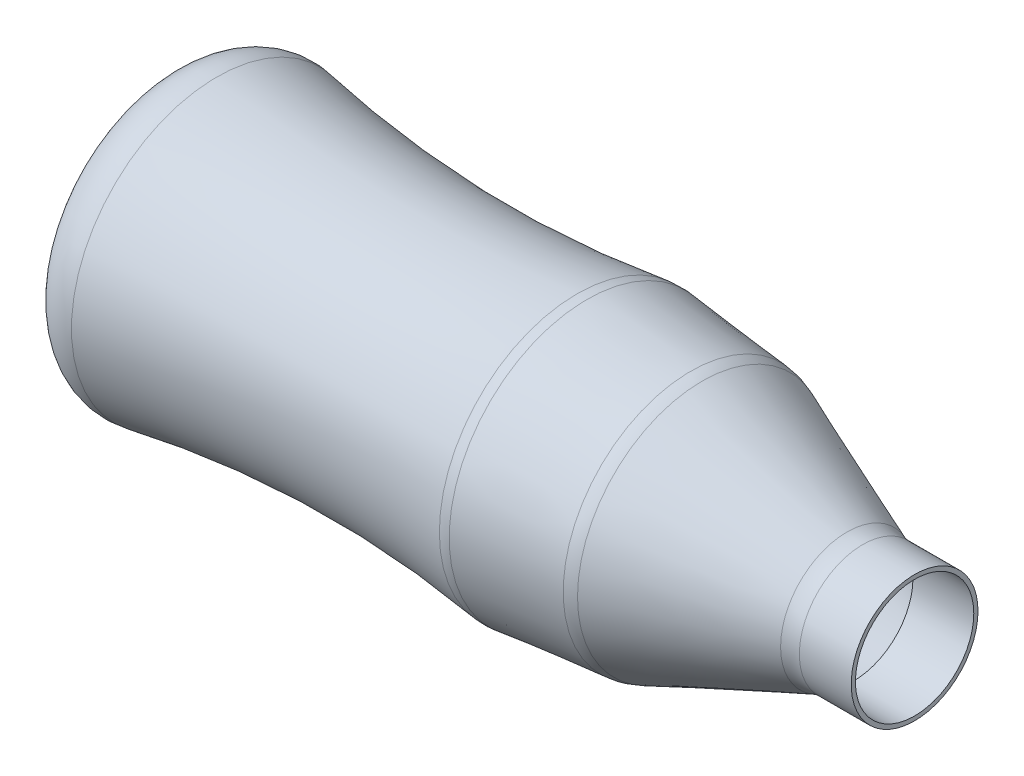
from build123d import *

# Parameters (mm, degrees)
FILLET1_R = 10


with BuildPart() as part:
    # Sketch1 → Revolve2 (revolve)
    with BuildSketch(Plane.XY, mode=Mode.PRIVATE) as revolve2_sk:
        with BuildLine():
            Line((-72.007624159, 0), (-72.007624159, 24.57))
            ThreePointArc((-72.007624159, 24.57), (-68.418740423, 32.244476415), (-60.228106509, 34.410392113))
            ThreePointArc((-60.228106509, 34.410392113), (-17.104532656, 30.124451731), (26.151893491, 32.75))
            Line((26.151893491, 32.75), (53.241893491, 30))
            Line((53.241893491, 30), (90.631893491, 15))
            Line((90.631893491, 15), (104.821893491, 15))
            Line((104.821893491, 15), (104.821893491, 14))
            Line((104.821893491, 14), (103.821893491, 14))
            Line((103.821893491, 14), (90.438785202, 14))
            Line((90.438785202, 14), (53.000518344, 29.019363543))
            Line((53.000518344, 29.019363543), (26.17157318, 31.74286296))
            ThreePointArc((26.17157318, 31.74286296), (-17.184498372, 29.125810874), (-60.406058274, 33.426352902))
            ThreePointArc((-60.406058274, 33.426352902), (-67.777628796, 31.477028774), (-71.007624159, 24.57))
            Line((-71.007624159, 24.57), (-71.007624159, 0))
            Line((-71.007624159, 0), (-72.007624159, 0))
        make_face()
    revolve(revolve2_sk.sketch.rotate(Axis((0, 0, 0), (-1, 0, 0)), 90), axis=Axis((0, 0, 0), (-1, 0, 0)))

    # Fillet1
    fillet1_edges = [part.edges().sort_by_distance(p)[0] for p in [
        (53.241893491, 0, 30),
        (90.631893491, 0, 15),
        (26.151893491, 0, 32.75),
    ]]
    fillet(fillet1_edges, radius=FILLET1_R)


solid = part.part
